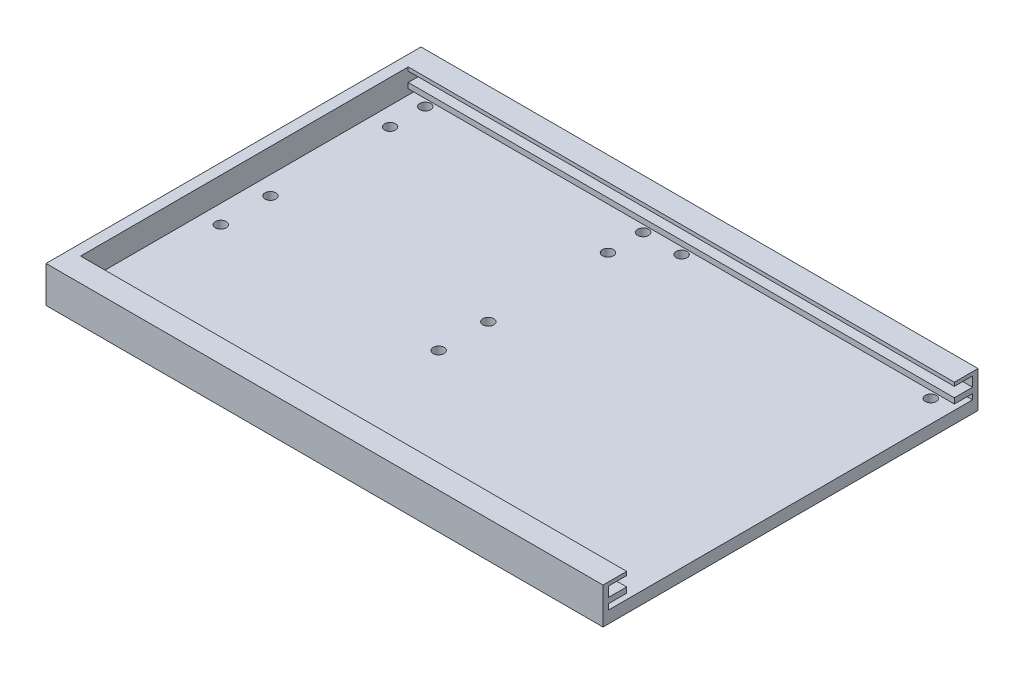
from build123d import *

# Parameters (mm, degrees)
SKETCH_1_W          = 103
SKETCH_1_H          = 10
EXTRUDE_1_DEPTH     = 153
CUT_EXTRUDE_1_DEPTH = 150
CUT_EXTRUDE_2_DEPTH = 150
CUT_EXTRUDE_3_DEPTH = 150
CUT_EXTRUDE_4_DEPTH = 150
CUT_EXTRUDE_6_DEPTH = 4
SKETCH_7_R          = 1.5
CUT_EXTRUDE_7_DEPTH = 4


with BuildPart() as part:
    # 草图1 → 凸台-拉伸1 (new body)
    with BuildSketch(Plane(origin=(0, 0, 0), x_dir=(0, 0, -1), z_dir=(1, 0, 0))):
        Rectangle(SKETCH_1_W, SKETCH_1_H)
    extrude(amount=EXTRUDE_1_DEPTH)

    # 草图2 → 切除-拉伸1 (cut)
    with BuildSketch(Plane(origin=(153, 0, 0), x_dir=(0, 0, -1), z_dir=(1, 0, 0))):
        Polygon((0, 5), (-45, 5), (-45, 4), (45, 4), (45, 5), align=None)
    extrude(amount=-CUT_EXTRUDE_1_DEPTH, mode=Mode.SUBTRACT)

    # 草图3 → 切除-拉伸2 (cut)
    with BuildSketch(Plane(origin=(153, 0, 0), x_dir=(0, 0, -1), z_dir=(1, 0, 0))):
        Polygon((0, 4), (-50, 4), (-50, 1.3), (50, 1.3), (50, 4), align=None)
    extrude(amount=-CUT_EXTRUDE_2_DEPTH, mode=Mode.SUBTRACT)

    # 草图4 → 切除-拉伸3 (cut)
    with BuildSketch(Plane(origin=(153, 0, 0), x_dir=(0, 0, -1), z_dir=(1, 0, 0))):
        Polygon((0, 1.3), (-45, 1.3), (-45, -0.2), (45, -0.2), (45, 1.3), align=None)
    extrude(amount=-CUT_EXTRUDE_3_DEPTH, mode=Mode.SUBTRACT)

    # 草图5 → 切除-拉伸4 (cut)
    with BuildSketch(Plane(origin=(153, 0, 0), x_dir=(0, 0, -1), z_dir=(1, 0, 0))):
        Polygon((0, -0.2), (-50, -0.2), (-50, -1.7), (50, -1.7), (50, -0.2), align=None)
    extrude(amount=-CUT_EXTRUDE_4_DEPTH, mode=Mode.SUBTRACT)

    # 草图6 → 切除-拉伸6 (cut)
    with BuildSketch(Plane.XZ.offset(5)):
        with BuildLine():
            Line((78.475, 42.927791829), (78.475, 44.427791829))
            Line((78.475, 44.427791829), (79.975, 44.427791829))
            ThreePointArc((79.975, 44.427791829), (77.414339828, 45.488452001), (78.475, 42.927791829))
        make_face()
        with BuildLine():
            Line((79.975, 44.427791829), (78.475, 44.427791829))
            Line((78.475, 44.427791829), (78.475, 42.927791829))
            ThreePointArc((78.475, 42.927791829), (79.535660172, 43.367131657), (79.975, 44.427791829))
        make_face()
        with BuildLine():
            ThreePointArc((148.425, 44.427791829), (146.925, 45.927791829), (145.425, 44.427791829))
            Line((145.425, 44.427791829), (146.925, 44.427791829))
            Line((146.925, 44.427791829), (146.925, 42.927791829))
            ThreePointArc((146.925, 42.927791829), (147.985660172, 43.367131657), (148.425, 44.427791829))
        make_face()
        with BuildLine():
            Line((146.925, 44.427791829), (145.425, 44.427791829))
            ThreePointArc((145.425, 44.427791829), (145.864339828, 43.367131657), (146.925, 42.927791829))
            Line((146.925, 42.927791829), (146.925, 44.427791829))
        make_face()
        with BuildLine():
            ThreePointArc((79.975, -44.602208171), (79.535660172, -43.541547999), (78.475, -43.102208171))
            Line((78.475, -43.102208171), (78.475, -44.602208171))
            Line((78.475, -44.602208171), (79.975, -44.602208171))
        make_face()
        with BuildLine():
            Line((78.475, -44.602208171), (78.475, -43.102208171))
            ThreePointArc((78.475, -43.102208171), (77.414339828, -45.662868343), (79.975, -44.602208171))
            Line((79.975, -44.602208171), (78.475, -44.602208171))
        make_face()
        with BuildLine():
            ThreePointArc((148.425, -44.602208171), (147.985660172, -43.541547999), (146.925, -43.102208171))
            Line((146.925, -43.102208171), (146.925, -44.602208171))
            Line((146.925, -44.602208171), (145.425, -44.602208171))
            ThreePointArc((145.425, -44.602208171), (146.925, -46.102208171), (148.425, -44.602208171))
        make_face()
        with BuildLine():
            Line((146.925, -44.602208171), (146.925, -43.102208171))
            ThreePointArc((146.925, -43.102208171), (145.864339828, -43.541547999), (145.425, -44.602208171))
            Line((145.425, -44.602208171), (146.925, -44.602208171))
        make_face()
    extrude(amount=-CUT_EXTRUDE_6_DEPTH, mode=Mode.SUBTRACT)

    # 草图7 → 切除-拉伸7 (cut)
    with BuildSketch(Plane.XZ.offset(5)):
        with BuildLine():
            Line((8.075, 42.925), (8.075, 44.425))
            Line((8.075, 44.425), (9.575, 44.425))
            ThreePointArc((9.575, 44.425), (7.014339828, 45.485660172), (8.075, 42.925))
        make_face()
        with BuildLine():
            Line((9.575, 44.425), (8.075, 44.425))
            Line((8.075, 44.425), (8.075, 42.925))
            ThreePointArc((8.075, 42.925), (9.135660172, 43.364339828), (9.575, 44.425))
        make_face()
        with BuildLine():
            ThreePointArc((69.425, 44.425), (67.925, 45.925), (66.425, 44.425))
            Line((66.425, 44.425), (67.925, 44.425))
            Line((67.925, 44.425), (67.925, 42.925))
            ThreePointArc((67.925, 42.925), (68.985660172, 43.364339828), (69.425, 44.425))
        make_face()
        with BuildLine():
            Line((67.925, 44.425), (66.425, 44.425))
            ThreePointArc((66.425, 44.425), (66.864339828, 43.364339828), (67.925, 42.925))
            Line((67.925, 42.925), (67.925, 44.425))
        make_face()
        with BuildLine():
            Line((8.075, -3.575), (8.075, -2.075))
            Line((8.075, -2.075), (9.575, -2.075))
            ThreePointArc((9.575, -2.075), (7.014339828, -1.014339828), (8.075, -3.575))
        make_face()
        with BuildLine():
            Line((9.575, -2.075), (8.075, -2.075))
            Line((8.075, -2.075), (8.075, -3.575))
            ThreePointArc((8.075, -3.575), (9.135660172, -3.135660172), (9.575, -2.075))
        make_face()
        with BuildLine():
            ThreePointArc((69.425, -2.075), (67.925, -0.575), (66.425, -2.075))
            Line((66.425, -2.075), (67.925, -2.075))
            Line((67.925, -2.075), (67.925, -3.575))
            ThreePointArc((67.925, -3.575), (68.985660172, -3.135660172), (69.425, -2.075))
        make_face()
        with BuildLine():
            Line((67.925, -2.075), (66.425, -2.075))
            ThreePointArc((66.425, -2.075), (66.864339828, -3.135660172), (67.925, -3.575))
            Line((67.925, -3.575), (67.925, -2.075))
        make_face()
        with BuildLine():
            ThreePointArc((69.425, 11.575), (68.985660172, 12.635660172), (67.925, 13.075))
            Line((67.925, 13.075), (67.925, 11.575))
            Line((67.925, 11.575), (66.425, 11.575))
            ThreePointArc((66.425, 11.575), (67.925, 10.075), (69.425, 11.575))
        make_face()
        with BuildLine():
            Line((67.925, 11.575), (67.925, 13.075))
            ThreePointArc((67.925, 13.075), (66.864339828, 12.635660172), (66.425, 11.575))
            Line((66.425, 11.575), (67.925, 11.575))
        make_face()
        with BuildLine():
            ThreePointArc((9.575, 11.575), (9.135660172, 12.635660172), (8.075, 13.075))
            Line((8.075, 13.075), (8.075, 11.575))
            Line((8.075, 11.575), (9.575, 11.575))
        make_face()
        with BuildLine():
            Line((8.075, 11.575), (8.075, 13.075))
            ThreePointArc((8.075, 13.075), (7.014339828, 10.514339828), (9.575, 11.575))
            Line((9.575, 11.575), (8.075, 11.575))
        make_face()
        with BuildLine():
            ThreePointArc((9.575, -34.925), (9.135660172, -33.864339828), (8.075, -33.425))
            Line((8.075, -33.425), (8.075, -34.925))
            Line((8.075, -34.925), (9.575, -34.925))
        make_face()
        with BuildLine():
            Line((8.075, -34.925), (8.075, -33.425))
            ThreePointArc((8.075, -33.425), (7.014339828, -35.985660172), (9.575, -34.925))
            Line((9.575, -34.925), (8.075, -34.925))
        make_face()
        with BuildLine():
            ThreePointArc((69.425, -34.925), (68.985660172, -33.864339828), (67.925, -33.425))
            Line((67.925, -33.425), (67.925, -34.925))
            Line((67.925, -34.925), (66.425, -34.925))
            ThreePointArc((66.425, -34.925), (67.925, -36.425), (69.425, -34.925))
        make_face()
        with BuildLine():
            Line((67.925, -34.925), (67.925, -33.425))
            ThreePointArc((67.925, -33.425), (66.864339828, -33.864339828), (66.425, -34.925))
            Line((66.425, -34.925), (67.925, -34.925))
        make_face()
        with Locations(Location((67.925, -44.602208171, 0), (0, 0, 270))):
            Circle(SKETCH_7_R)
        with Locations(Location((8.075, -44.602208171, 0), (0, 0, 270))):
            Circle(SKETCH_7_R)
    extrude(amount=-CUT_EXTRUDE_7_DEPTH, mode=Mode.SUBTRACT)


solid = part.part
